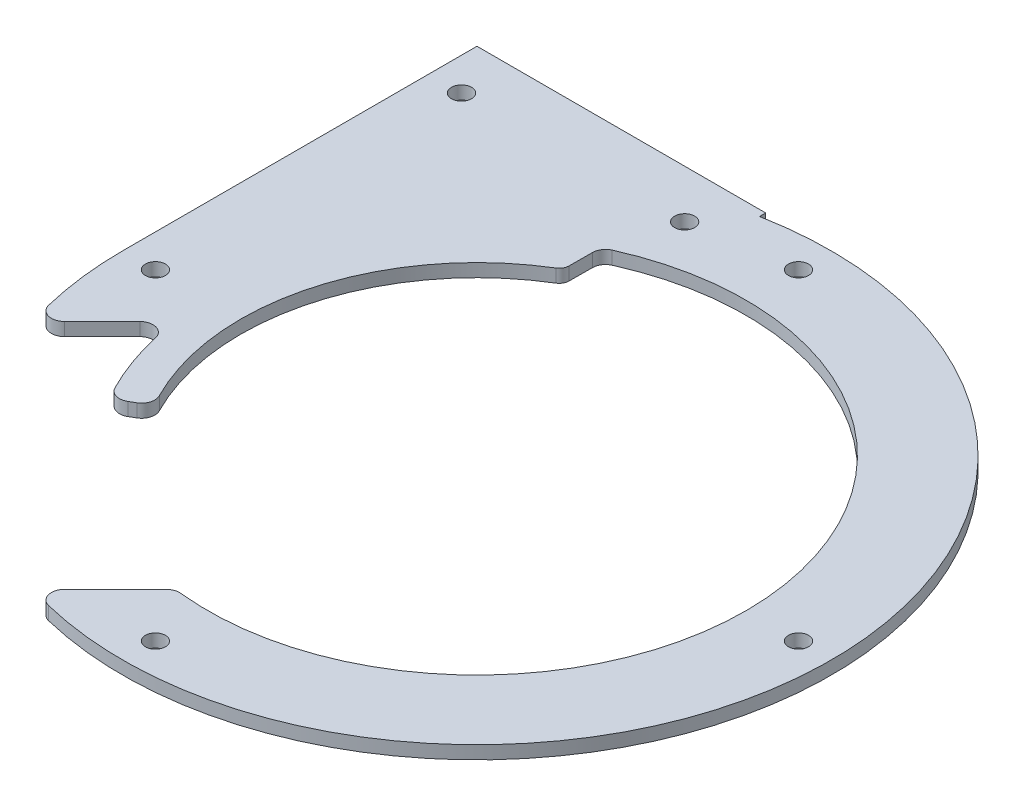
from build123d import *

# Parameters (mm, degrees)
SKETCH_1_R          = 41
SKETCH_1_R_2        = 1.525
EXTRUDE_1_DEPTH     = 2
EXTRUDE_3_DEPTH     = 2
FILLET_1_R          = 2
EXTRUDE_5_DEPTH     = 2
CUT_EXTRUDE_1_DEPTH = 10
FILLET_3_R          = 2


with BuildPart() as part:
    # 草图1 → 凸台-拉伸1 (new body)
    with BuildSketch(Plane(origin=(0, 0, 0), x_dir=(1, 0, 0), z_dir=(0, 1, 0))):
        with BuildLine():
            Line((-54, 0), (-54, 54))
            Line((-54, 54), (-10, 54))
            Line((-10, 54), (-10, 53.065996646))
            ThreePointArc((-10, 53.065996646), (41.569219382, -34.467375879), (-54, 0))
        make_face()
        with Locations(Location((0, 0, 0), (0, 0, 270))):
            Circle(SKETCH_1_R, mode=Mode.SUBTRACT)
        with Locations(Location((-15, 46.647615159, 0), (0, 0, 270))):
            Circle(SKETCH_1_R_2, mode=Mode.SUBTRACT)
        with Locations(Location((0, 49, 0), (0, 0, 270))):
            Circle(SKETCH_1_R_2, mode=Mode.SUBTRACT)
        with Locations(Location((49, 0, 0), (0, 0, 270))):
            Circle(SKETCH_1_R_2, mode=Mode.SUBTRACT)
        with Locations(Location((0, -49, 0), (0, 0, 270))):
            Circle(SKETCH_1_R_2, mode=Mode.SUBTRACT)
        with Locations(Location((-49, 0, 0), (0, 0, 270))):
            Circle(SKETCH_1_R_2, mode=Mode.SUBTRACT)
        with Locations(Location((-49, 46.647615159, 0), (0, 0, 270))):
            Circle(SKETCH_1_R_2, mode=Mode.SUBTRACT)
    extrude(amount=EXTRUDE_1_DEPTH)

    # 草图2 → 凸台-拉伸3 (add)
    with BuildSketch(Plane(origin=(0, 0, 0), x_dir=(1, 0, 0), z_dir=(0, 1, 0))):
        with BuildLine():
            Line((-41, 0), (-37.46998799, 0))
            ThreePointArc((-37.46998799, 0), (-36.430757506, 0.418334617), (-35.971188471, 1.44))
            ThreePointArc((-35.971188471, 1.44), (-31.023847214, 18.262554696), (-18.716133348, 30.752338976))
            ThreePointArc((-18.716133348, 30.752338976), (-18.190087037, 31.295672989), (-17.99598895, 32.026605615))
            Line((-17.99598895, 32.026605615), (-17.973217018, 36.850555898))
            ThreePointArc((-17.973217018, 36.850555898), (-34.769971942, 21.726689834), (-41, 0))
        make_face()
    extrude(amount=EXTRUDE_3_DEPTH)

    # 圆角1
    fillet_1_edges = [part.edges().sort_by_distance(p)[0] for p in [
        (-17.973217018, 1, -36.850555898),
        (-41, 1, 0),
    ]]
    fillet(fillet_1_edges, radius=FILLET_1_R)

    # 草图4 → 凸台-拉伸5 (add)
    with BuildSketch(Plane.XZ):
        with BuildLine():
            Line((-38.948684188, 0), (-37.46998799, 0))
            ThreePointArc((-37.46998799, 0), (-36.430757506, -0.418334617), (-35.971188471, -1.44))
            ThreePointArc((-35.971188471, -1.44), (-34.952758609, 8.620015408), (-31.176914536, 18))
            Line((-31.176914536, 18), (-35.507041555, 20.5))
            ThreePointArc((-35.507041555, 20.5), (-39.317748075, 11.623884304), (-40.946052608, 2.102564103))
            ThreePointArc((-40.946052608, 2.102564103), (-40.398706292, 0.622525537), (-38.948684188, 0))
        make_face()
    extrude(amount=-EXTRUDE_5_DEPTH)

    # 草图5 → 切除-拉伸1 (cut)
    with BuildSketch(Plane.XZ):
        with BuildLine():
            Line((-16.167566472, 51.522905531), (-5.300581056, 40.655920116))
            ThreePointArc((-5.300581056, 40.655920116), (-28.991378029, 28.991378029), (-40.655920116, 5.300581056))
            Line((-40.655920116, 5.300581056), (-51.522905531, 16.167566472))
            ThreePointArc((-51.522905531, 16.167566472), (-38.183766184, 38.183766184), (-16.167566472, 51.522905531))
        make_face()
    extrude(amount=-CUT_EXTRUDE_1_DEPTH, mode=Mode.SUBTRACT)

    # 圆角3
    fillet_3_edges = [part.edges().sort_by_distance(p)[0] for p in [
        (-5.300581056, 1, 40.655920116),
        (-40.655920116, 1, 5.300581056),
        (-35.507041555, 1, 20.5),
        (-31.176914536, 1, 18),
        (-51.522905531, 1, 16.167566472),
        (-16.167566472, 1, 51.522905531),
    ]]
    fillet(fillet_3_edges, radius=FILLET_3_R)


solid = part.part
